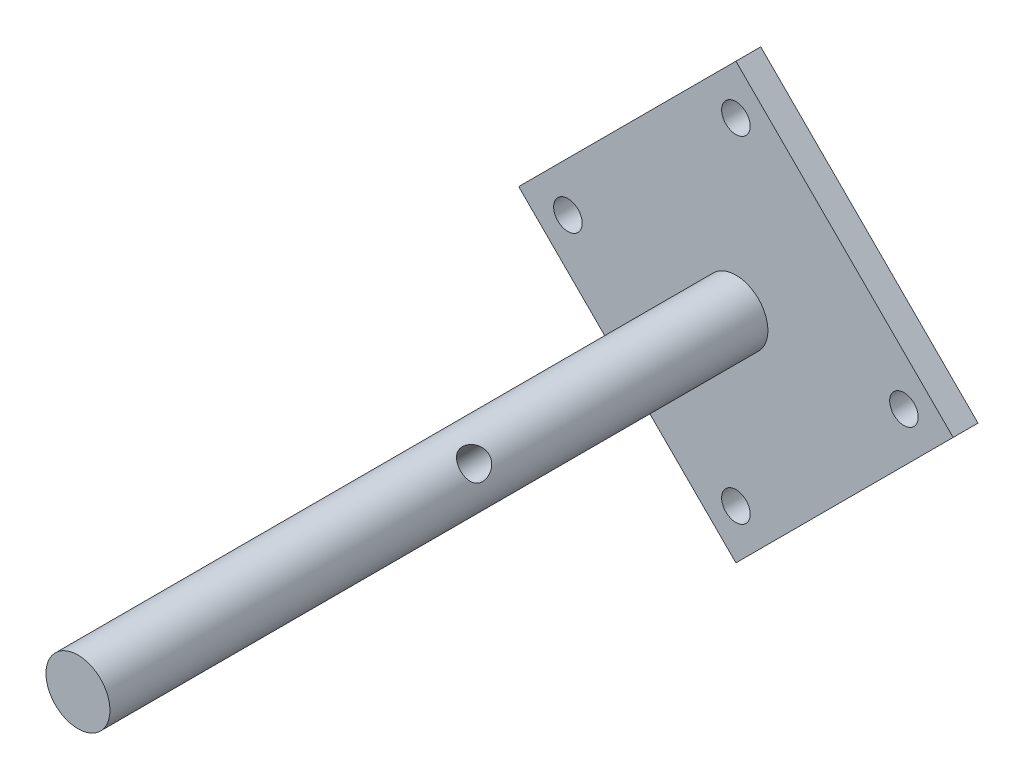
from build123d import *

# Parameters (mm, degrees)
SKETCH_1_R          = 2.575
EXTRUDE_1_DEPTH     = 55
SKETCH_2_W          = 35
SKETCH_2_H          = 35
EXTRUDE_2_DEPTH     = 2
SKETCH_8_R          = 1.15
CUT_EXTRUDE_5_DEPTH = 5
SKETCH_10_OUTSIDE_W = 51.798
SKETCH_10_OUTSIDE_H = 51.798
CUT_EXTRUDE_6_DEPTH = 5
SKETCH_14_R         = 1.15
CUT_EXTRUDE_7_DEPTH = 20


with BuildPart() as part:
    # 스케치1 → 보스-돌출1 (new body)
    with BuildSketch(Plane.XY):
        Circle(SKETCH_1_R)
    extrude(amount=EXTRUDE_1_DEPTH)

    # 스케치2 → 보스-돌출2 (add)
    with BuildSketch(Plane(origin=(0, 0, 0), x_dir=(-1, 0, 0), z_dir=(0, 0, -1))):
        Rectangle(SKETCH_2_W, SKETCH_2_H)
    extrude(amount=-EXTRUDE_2_DEPTH)

    # 스케치8 → 컷-돌출5 (cut)
    with BuildSketch(Plane(origin=(0, 0, 0), x_dir=(-1, 0, 0), z_dir=(0, 0, -1))):
        with Locations((13.533711803, 0)):
            Circle(SKETCH_8_R)
        with Locations((0, -13.533711803)):
            Circle(SKETCH_8_R)
        with Locations((-13.533711803, 0)):
            Circle(SKETCH_8_R)
        with Locations((0, 13.533711803)):
            Circle(SKETCH_8_R)
    extrude(amount=-CUT_EXTRUDE_5_DEPTH, mode=Mode.SUBTRACT)

    # 스케치10 outside → 컷-돌출6 (cut)
    with BuildSketch(Plane.XY.offset(2)):
        Rectangle(SKETCH_10_OUTSIDE_W, SKETCH_10_OUTSIDE_H)
        Polygon((-17.5, 0), (0, 17.5), (17.5, 0), (0, -17.5), align=None, mode=Mode.SUBTRACT)
    extrude(amount=-CUT_EXTRUDE_6_DEPTH, mode=Mode.SUBTRACT)

    # 스케치14 → 컷-돌출7 (cut)
    with BuildSketch(Plane(origin=(8.75, 8.75, 0), x_dir=(0.7071067811865475, -0.7071067811865477, 0), z_dir=(0.7071067811865477, 0.7071067811865475, 0))):
        with Locations(Location((0, -24.85, 0), (0, 0, 180))):
            Circle(SKETCH_14_R)
    extrude(amount=-CUT_EXTRUDE_7_DEPTH, mode=Mode.SUBTRACT)


solid = part.part
